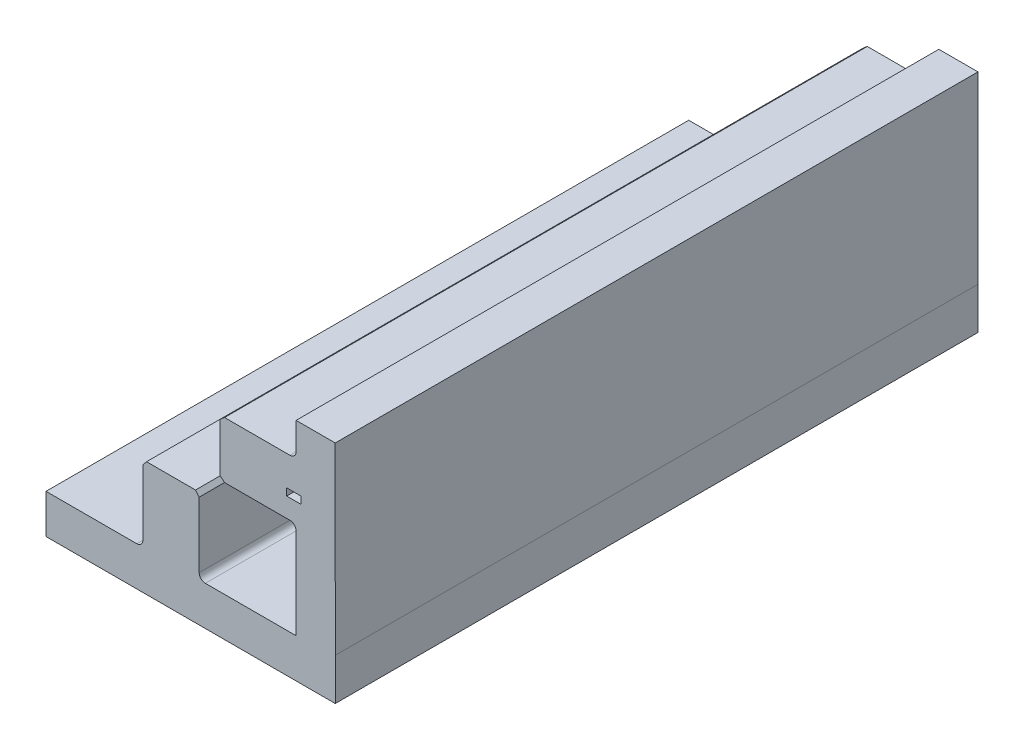
from build123d import *

# Parameters (mm, degrees)
BOSS_EXTRUDE1_DEPTH = 66.675
CUT_EXTRUDE1_REACH  = 75.8
CUT_EXTRUDE2_REACH  = 75.8
SKETCH5_W           = 1.489310624
SKETCH5_H           = 0.739469686
CUT_EXTRUDE3_DEPTH  = 2.54


with BuildPart() as part:
    # Sketch1 → Boss-Extrude1 (new body)
    with BuildSketch(Plane(origin=(0, 0, -3683), x_dir=(-1, 0, 0), z_dir=(0, 0, -1))):
        with BuildLine():
            Line((7.945265893, 3.588862728), (-1.198734107, 3.588862728))
            ThreePointArc((-1.198734107, 3.588862728), (-1.647746913, 3.774849922), (-1.833734107, 4.223862728))
            Line((-1.833734107, 4.223862728), (-1.833734107, 5.747862728))
            ThreePointArc((-1.833734107, 5.747862728), (-1.647746913, 6.196875535), (-1.198734107, 6.382862728))
            Line((-1.198734107, 6.382862728), (1.621629442, 6.382862728))
            Line((1.621629442, 6.382862728), (1.621629442, 6.890862686))
            Line((1.621629442, 6.890862686), (-2.214734107, 11.462862728))
            Line((-2.214734107, 11.462862728), (-7.294734107, 11.462862728))
            Line((-7.294734107, 11.462862728), (-11.131097656, 6.890862686))
            Line((-11.131097656, 6.890862686), (-11.131097656, 6.382862728))
            Line((-11.131097656, 6.382862728), (-8.310734107, 6.382862728))
            ThreePointArc((-8.310734107, 6.382862728), (-7.861721301, 6.196875535), (-7.675734107, 5.747862728))
            Line((-7.675734107, 5.747862728), (-7.675734107, 4.223862728))
            ThreePointArc((-7.675734107, 4.223862728), (-7.861721301, 3.774849922), (-8.310734107, 3.588862728))
            Line((-8.310734107, 3.588862728), (-17.454734107, 3.588862728))
            Line((-17.454734107, 3.588862728), (-17.727921752, 3.588862728))
            Line((-17.727921752, 3.588862728), (-17.727921752, 3.858842754))
            Line((-17.727921752, 3.858842754), (-17.728361466, 13.002372481))
            ThreePointArc((-17.728361466, 13.002372481), (-17.542256287, 13.451715967), (-17.092921752, 13.637842754))
            Line((-17.092921752, 13.637842754), (-15.568921752, 13.637842754))
            ThreePointArc((-15.568921752, 13.637842754), (-15.119908946, 13.45185556), (-14.933921752, 13.002842754))
            Line((-14.933921752, 13.002842754), (-14.933921752, 10.182479205))
            Line((-14.933921752, 10.182479205), (-14.425921794, 10.182479205))
            Line((-14.425921794, 10.182479205), (-9.853921752, 14.018842754))
            Line((-9.853921752, 14.018842754), (-9.853921752, 19.098842754))
            Line((-9.853921752, 19.098842754), (-14.425921794, 22.935206303))
            Line((-14.425921794, 22.935206303), (-14.933921752, 22.935206303))
            Line((-14.933921752, 22.935206303), (-14.933921752, 20.114842754))
            ThreePointArc((-14.933921752, 20.114842754), (-15.119908946, 19.665829948), (-15.568921752, 19.479842754))
            Line((-15.568921752, 19.479842754), (-17.092921752, 19.479842754))
            ThreePointArc((-17.092921752, 19.479842754), (-17.542476558, 19.66604812), (-17.728703542, 20.11559397))
            Line((-17.728703542, 20.11559397), (-17.728839138, 22.935206303))
            Line((-17.728839138, 22.935206303), (-21.787214199, 22.935206303))
            Line((-21.787214199, 22.935206303), (-21.791921752, 3.859128788))
            Line((-21.791921752, 3.859128788), (-21.791921752, 3.588862728))
            Line((-21.791921752, 3.588862728), (-21.791921752, -0.475137272))
            Line((-21.791921752, -0.475137272), (-17.727921752, -0.475137272))
            Line((-17.727921752, -0.475137272), (-17.454774021, -0.475137272))
            Line((-17.454774021, -0.475137272), (7.945225979, -0.475137272))
            Line((7.945225979, -0.475137272), (8.215492039, -0.475137272))
            Line((8.215492039, -0.475137272), (8.215492039, 3.588862728))
            Line((8.215492039, 3.588862728), (7.945265893, 3.588862728))
        make_face()
    extrude(amount=BOSS_EXTRUDE1_DEPTH)

    # Sketch2 → Cut-Extrude1 (cut, up to next)
    with BuildSketch(Plane.XY.offset(-3683), mode=Mode.PRIVATE) as cut_extrude1_sk1:
        with BuildLine():
            Line((11.131097656, 6.890862686), (11.131097656, 6.382862728))
            Line((11.131097656, 6.382862728), (8.310734107, 6.382862728))
            ThreePointArc((8.310734107, 6.382862728), (7.861721301, 6.196875535), (7.675734107, 5.747862728))
            Line((7.675734107, 5.747862728), (7.675734107, 11.00880461))
            Line((7.675734107, 11.00880461), (11.131097656, 6.890862686))
        make_face()
    cut_extrude1_tool1 = extrude(cut_extrude1_sk1.sketch, amount=-CUT_EXTRUDE1_REACH, mode=Mode.PRIVATE) & part.part
    # Sketch2 → Cut-Extrude1 (cut, up to next)
    with BuildSketch(Plane.XY.offset(-3683), mode=Mode.PRIVATE) as cut_extrude1_sk2:
        with BuildLine():
            Line((1.833734107, 5.747862728), (1.833734107, 11.00880461))
            Line((1.833734107, 11.00880461), (-1.621629442, 6.890862686))
            Line((-1.621629442, 6.890862686), (-1.621629442, 6.382862728))
            Line((-1.621629442, 6.382862728), (1.198734107, 6.382862728))
            ThreePointArc((1.198734107, 6.382862728), (1.647746913, 6.196875535), (1.833734107, 5.747862728))
        make_face()
    cut_extrude1_tool2 = extrude(cut_extrude1_sk2.sketch, amount=-CUT_EXTRUDE1_REACH, mode=Mode.PRIVATE) & part.part
    add(cut_extrude1_tool1.solids().sort_by_distance((8.930632, 7.925168, -3683))[0], mode=Mode.SUBTRACT)
    add(cut_extrude1_tool2.solids().sort_by_distance((0.578837, 7.925168, -3683))[0], mode=Mode.SUBTRACT)

    # Sketch3 → Cut-Extrude2 (cut, up to next)
    with BuildSketch(Plane.XY.offset(-3683), mode=Mode.PRIVATE) as cut_extrude2_sk1:
        with BuildLine():
            Line((15.568921752, 19.479842754), (10.307979871, 19.479842754))
            Line((10.307979871, 19.479842754), (14.425921794, 22.935206303))
            Line((14.425921794, 22.935206303), (14.933921752, 22.935206303))
            Line((14.933921752, 22.935206303), (14.933921752, 20.114842754))
            ThreePointArc((14.933921752, 20.114842754), (15.119908946, 19.665829948), (15.568921752, 19.479842754))
        make_face()
    cut_extrude2_tool1 = extrude(cut_extrude2_sk1.sketch, amount=-CUT_EXTRUDE2_REACH, mode=Mode.PRIVATE) & part.part
    # Sketch3 → Cut-Extrude2 (cut, up to next)
    with BuildSketch(Plane.XY.offset(-3683), mode=Mode.PRIVATE) as cut_extrude2_sk2:
        with BuildLine():
            Line((10.307979871, 13.637842754), (14.425921794, 10.182479205))
            Line((14.425921794, 10.182479205), (14.933921752, 10.182479205))
            Line((14.933921752, 10.182479205), (14.933921752, 13.002842754))
            ThreePointArc((14.933921752, 13.002842754), (15.119908946, 13.45185556), (15.568921752, 13.637842754))
            Line((15.568921752, 13.637842754), (10.307979871, 13.637842754))
        make_face()
    cut_extrude2_tool2 = extrude(cut_extrude2_sk2.sketch, amount=-CUT_EXTRUDE2_REACH, mode=Mode.PRIVATE) & part.part
    add(cut_extrude2_tool1.solids().sort_by_distance((13.391616, 20.73474, -3683))[0], mode=Mode.SUBTRACT)
    add(cut_extrude2_tool2.solids().sort_by_distance((13.391616, 12.382945, -3683))[0], mode=Mode.SUBTRACT)

    # Sketch5 → Cut-Extrude3 (cut)
    with BuildSketch(Plane.XY.offset(-3683)):
        with Locations((17.496622798, 16.016291439)):
            Rectangle(SKETCH5_W, SKETCH5_H)
    extrude(amount=-CUT_EXTRUDE3_DEPTH, mode=Mode.SUBTRACT)


solid = part.part
